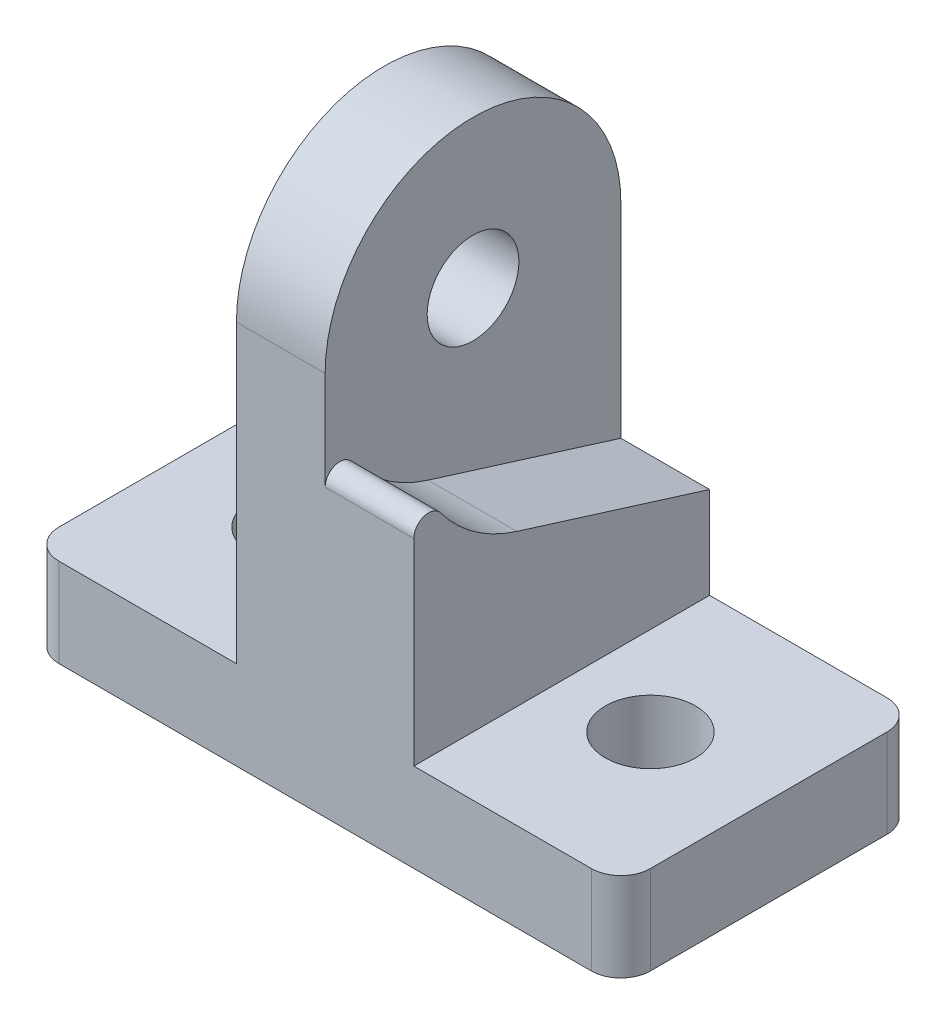
from build123d import *

# Parameters (mm, degrees)
SKETCH1_W           = 20
SKETCH1_H           = 10
SKETCH1_R           = 1.525
BOSS_EXTRUDE1_DEPTH = 3
SKETCH2_W           = 6
SKETCH2_H           = 10
BOSS_EXTRUDE2_DEPTH = 10
SKETCH3_R           = 5
SKETCH3_R_2         = 1.55
BOSS_EXTRUDE3_DEPTH = 3
CUT_EXTRUDE1_DEPTH  = 6
CUT_EXTRUDE2_START  = -3
SKETCH4_R           = 5
CUT_EXTRUDE2_DEPTH  = 3
FILLET2_R           = 1
CUT_EXTRUDE3_DEPTH  = 3
FILLET4_R           = 0.5
CUT_EXTRUDE4_DEPTH  = 3


with BuildPart() as part:
    # Sketch1 → Boss-Extrude1 (new body)
    with BuildSketch(Plane(origin=(0, 0, 0), x_dir=(1, 0, 0), z_dir=(0, 1, 0))):
        Rectangle(SKETCH1_W, SKETCH1_H)
        with Locations((-6, 0)):
            Circle(SKETCH1_R, mode=Mode.SUBTRACT)
        with Locations((6, 0)):
            Circle(SKETCH1_R, mode=Mode.SUBTRACT)
    extrude(amount=BOSS_EXTRUDE1_DEPTH)

    # Sketch2 → Boss-Extrude2 (add)
    with BuildSketch(Plane(origin=(0, 3, 0), x_dir=(1, 0, 0), z_dir=(0, 1, 0))):
        Rectangle(SKETCH2_W, SKETCH2_H)
    extrude(amount=BOSS_EXTRUDE2_DEPTH)

    # Sketch3 → Boss-Extrude3 (add)
    with BuildSketch(Plane.ZY.offset(3)):
        with Locations((0, 13)):
            Circle(SKETCH3_R)
        with Locations((0, 13)):
            Circle(SKETCH3_R_2, mode=Mode.SUBTRACT)
    extrude(amount=-BOSS_EXTRUDE3_DEPTH)

    # Sketch3<2> → Cut-Extrude1 (cut)
    with BuildSketch(Plane.ZY.offset(3)):
        with BuildLine():
            ThreePointArc((-1.55, 13), (0, 11.45), (1.55, 13))
            Line((1.55, 13), (-1.55, 13))
        make_face()
    extrude(amount=-CUT_EXTRUDE1_DEPTH, mode=Mode.SUBTRACT)

    # Sketch4 → Cut-Extrude2 (cut)
    with BuildSketch(Plane(origin=(3, 0, 0), x_dir=(0, 0, -1), z_dir=(1, 0, 0)).offset(CUT_EXTRUDE2_START)):
        with Locations((0, 13)):
            Circle(SKETCH4_R)
    extrude(amount=CUT_EXTRUDE2_DEPTH, mode=Mode.SUBTRACT)

    # Fillet2
    fillet2_edges = [part.edges().sort_by_distance(p)[0] for p in [
        (-10, 1.5, -5),
        (10, 1.5, -5),
        (10, 1.5, 5),
        (-10, 1.5, 5),
    ]]
    fillet(fillet2_edges, radius=FILLET2_R)

    # Sketch5 → Cut-Extrude3 (cut)
    with BuildSketch(Plane(origin=(3, 0, 0), x_dir=(0, 0, -1), z_dir=(1, 0, 0))):
        with BuildLine():
            Line((1.004987562, 8), (5, 8))
            Line((5, 8), (5, 14.099062692))
            Line((5, 14.099062692), (-5, 14.099062692))
            Line((-5, 14.099062692), (-5, 11.995012438))
            ThreePointArc((-5, 11.995012438), (-2.824900386, 8.753832574), (1.004987562, 8))
        make_face()
    extrude(amount=-CUT_EXTRUDE3_DEPTH, mode=Mode.SUBTRACT)

    # Fillet4
    fillet4_edges = [part.edges().sort_by_distance(p)[0] for p in [
        (1.5, 11.995012438, 5),
    ]]
    fillet(fillet4_edges, radius=FILLET4_R)

    # Sketch7 → Cut-Extrude4 (cut)
    with BuildSketch(Plane(origin=(3, 0, 0), x_dir=(0, 0, -1), z_dir=(1, 0, 0))):
        with BuildLine():
            Line((-1.517307451, 8.13093663), (5, 6.1))
            Line((5, 6.1), (5, 8))
            Line((5, 8), (1.004987562, 8))
            ThreePointArc((1.004987562, 8), (-0.264393679, 7.906857946), (-1.517307451, 8.13093663))
        make_face()
    extrude(amount=-CUT_EXTRUDE4_DEPTH, mode=Mode.SUBTRACT)


solid = part.part
